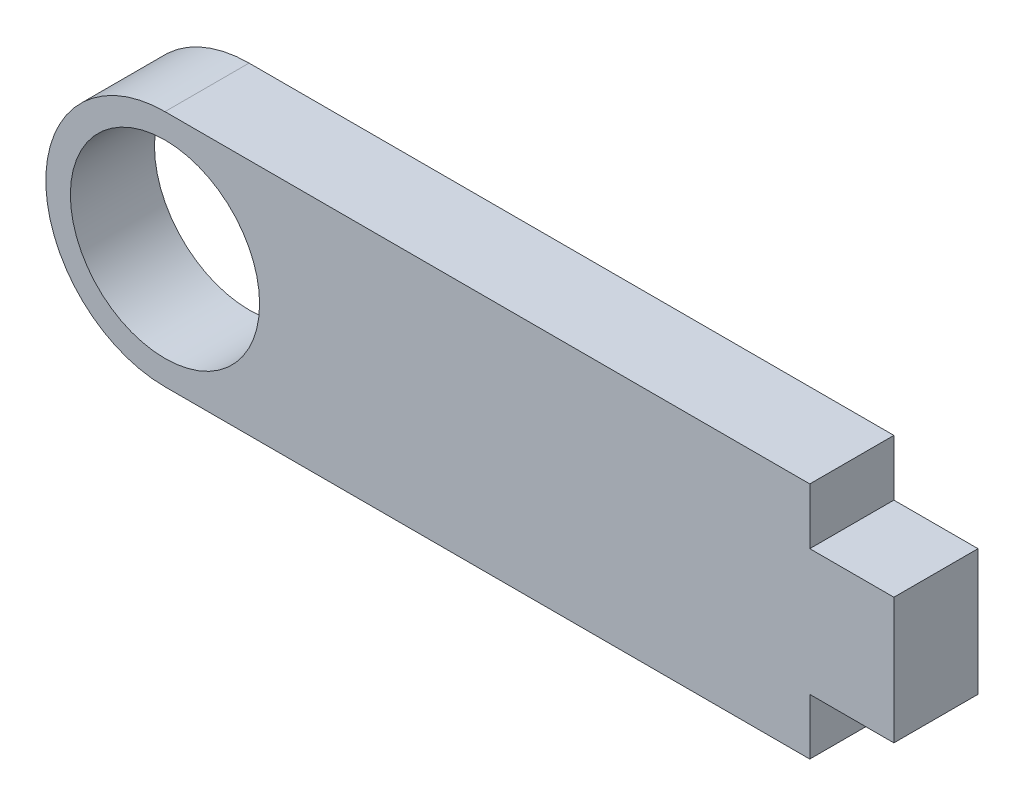
from build123d import *

# Parameters (mm, degrees)
CROQUIS1_R              = 3.375
SALIENTE_EXTRUIR1_DEPTH = 3


with BuildPart() as part:
    # Croquis1 → Saliente-Extruir1 (new body)
    with BuildSketch(Plane.XY):
        with BuildLine():
            Line((-26, 4.25), (-3, 4.25))
            Line((-3, 4.25), (-3, 6.25))
            Line((-3, 6.25), (0, 6.25))
            Line((0, 6.25), (0, 10.75))
            Line((0, 10.75), (-3, 10.75))
            Line((-3, 10.75), (-3, 12.75))
            Line((-3, 12.75), (-26, 12.75))
            ThreePointArc((-26, 12.75), (-30.25, 8.5), (-26, 4.25))
        make_face()
        with Locations((-26, 8.5)):
            Circle(CROQUIS1_R, mode=Mode.SUBTRACT)
    extrude(amount=SALIENTE_EXTRUIR1_DEPTH)


solid = part.part
